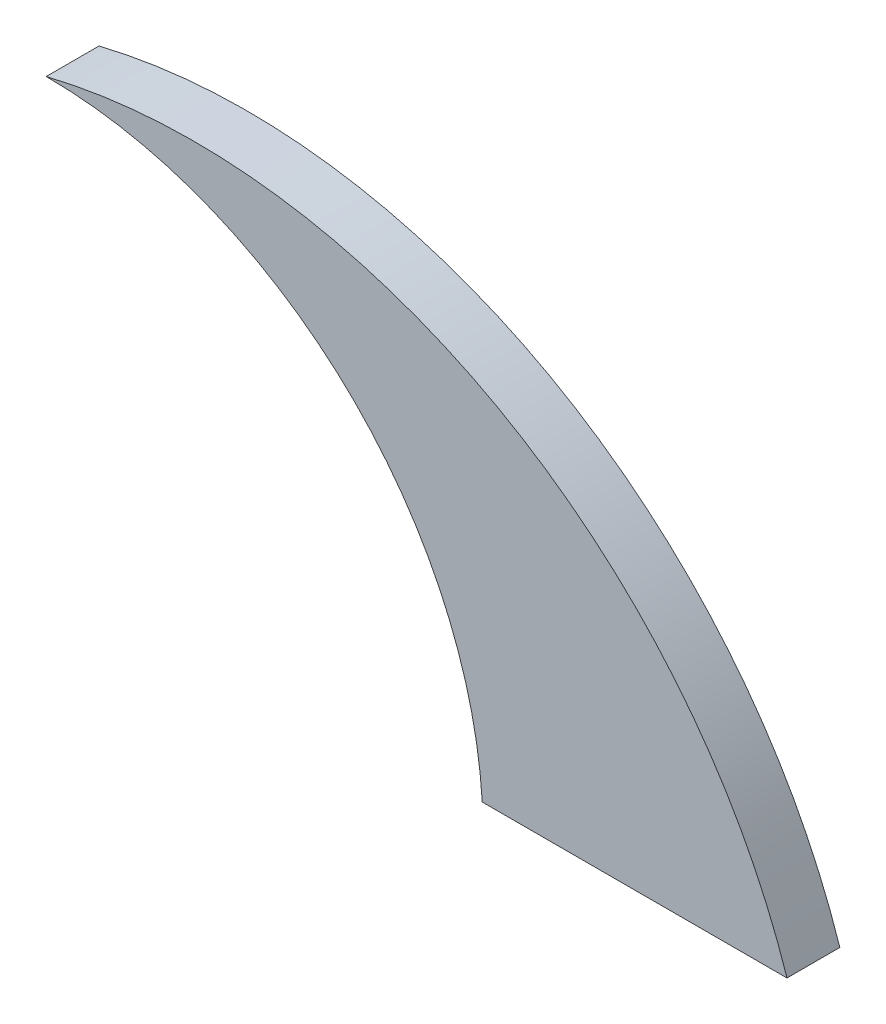
from build123d import *

# Parameters (mm, degrees)
BOSS_EXTRUDE1_DEPTH = 12.7


with BuildPart() as part:
    # Sketch1 → Boss-Extrude1 (new body)
    with BuildSketch(Plane.XY):
        with BuildLine():
            Line((104.804770884, 6.4), (178.040284447, 6.4))
            ThreePointArc((178.040284447, 6.4), (108.300255009, 90.51376029), (0, 105))
            ThreePointArc((0, 105), (71.947897815, 76.475486268), (104.804770884, 6.4))
        make_face()
    extrude(amount=BOSS_EXTRUDE1_DEPTH)


solid = part.part
